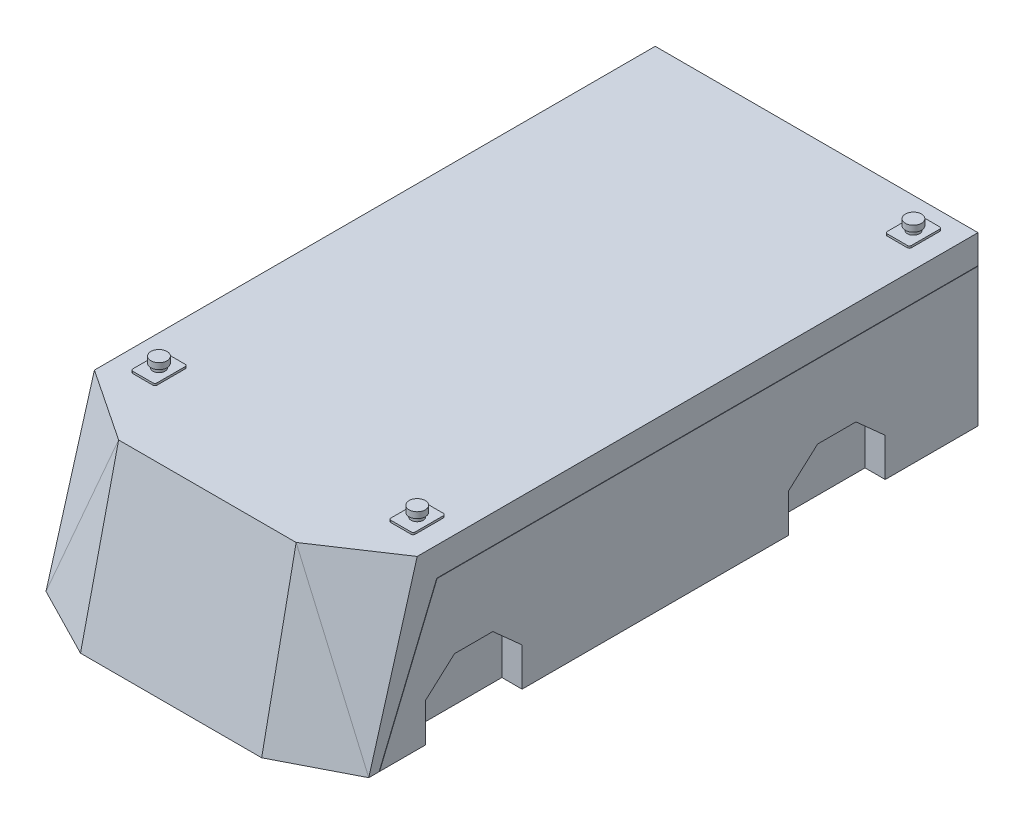
from build123d import *

# Parameters (mm, degrees)
CROQUIS1_W              = 800
CROQUIS1_H              = 1600
SALIENTE_EXTRUIR1_DEPTH = 415
CORTAR_EXTRUIR1_DEPTH   = 200
CORTAR_EXTRUIR2_DEPTH   = 200
CORTAR_EXTRUIR6_DEPTH   = 499
CORTAR_EXTRUIR8_DEPTH   = 359
CORTAR_EXTRUIR10_DEPTH  = 353
CORTAR_EXTRUIR12_DEPTH  = 514
CORTAR_EXTRUIR13_DEPTH  = 514
CORTAR_EXTRUIR16_DEPTH  = 50
CORTAR_EXTRUIR17_DEPTH  = 50
CORTAR_EXTRUIR18_DEPTH  = 1
CROQUIS20_W             = 800
CROQUIS20_H             = 1
CORTAR_EXTRUIR19_DEPTH  = 1
SALIENTE_EXTRUIR2_DEPTH = 5
CROQUIS22_R             = 15
SALIENTE_EXTRUIR3_DEPTH = 10
CROQUIS23_R             = 20
SALIENTE_EXTRUIR4_DEPTH = 15
SALIENTE_EXTRUIR5_DEPTH = 5
CROQUIS26_R             = 25
SALIENTE_EXTRUIR6_DEPTH = 75


with BuildPart() as part:
    # Croquis1 → Saliente-Extruir1 (new body)
    with BuildSketch(Plane(origin=(0, 0, 0), x_dir=(1, 0, 0), z_dir=(0, 1, 0))):
        with Locations((0, -407.98258177)):
            Rectangle(CROQUIS1_W, CROQUIS1_H)
    extrude(amount=SALIENTE_EXTRUIR1_DEPTH)

    # Croquis3 → Cortar-Extruir1 (cut)
    with BuildSketch(Plane(origin=(604.100569287, 262.019524028, 906.150853931), x_dir=(-0.8421068082275548, 0.1498081502111445, 0.5180865194802076), z_dir=(-0.5393107856670403, -0.23391793113269235, -0.8089661785005605))):
        Polygon((456.118589156, 88.118028239), (242.368981337, -310.549885139), (242.368981337, 121.451272267), align=None)
    extrude(amount=-CORTAR_EXTRUIR1_DEPTH, mode=Mode.SUBTRACT)

    # Croquis5 → Cortar-Extruir2 (cut)
    with BuildSketch(Plane(origin=(-604.100569287, 262.019524028, 906.150853931), x_dir=(-0.8421068082275548, -0.1498081502111445, -0.5180865194802076), z_dir=(0.5393107856670404, -0.2339179311326923, -0.8089661785005605))):
        Polygon((-242.368981337, -310.549885139), (-242.368981337, 121.451272267), (-456.118589156, 88.118028239), align=None)
    extrude(amount=-CORTAR_EXTRUIR2_DEPTH, mode=Mode.SUBTRACT)

    # Croquis8 → Cortar-Extruir6 (cut)
    with BuildSketch(Plane(origin=(0, 250.204627362, 1153.721337281), x_dir=(-1, 0, 0), z_dir=(0, -0.21194078521367435, -0.9772825095963864))):
        Polygon((220, 168.626135247), (400, -256.020776905), (-400, -256.020776905), (-220, 168.626135247), (0, 168.626135247), align=None)
    extrude(amount=-CORTAR_EXTRUIR6_DEPTH, mode=Mode.SUBTRACT)

    # Croquis12 → Cortar-Extruir8 (cut)
    with BuildSketch(Plane.XY.offset(1117.98258177)):
        Polygon((220, 415), (400, 0), (400, 415), align=None)
    extrude(amount=CORTAR_EXTRUIR8_DEPTH, mode=Mode.SUBTRACT)

    # Croquis14 → Cortar-Extruir10 (cut)
    with BuildSketch(Plane.XY.offset(1117.98258177)):
        Polygon((-220, 415), (-400, 0), (-400, 415), align=None)
    extrude(amount=CORTAR_EXTRUIR10_DEPTH, mode=Mode.SUBTRACT)

    # Croquis15 → Cortar-Extruir12 (cut)
    with BuildSketch(Plane(origin=(516.98244579, 224.233349981, 1008.11576929), x_dir=(-0.8942171635698928, 0.0971910742249457, 0.4369548712029846), z_dir=(-0.44763340400043405, -0.19415424751826063, -0.8728851378008463))):
        Polygon((327.082120211, -262.279632659), (130.821069596, -242.738649788), (332.114454842, 162.361304614), align=None)
    extrude(amount=-CORTAR_EXTRUIR12_DEPTH, mode=Mode.SUBTRACT)


with BuildPart() as body_2:
    # of the pieces the cut leaves, the one that is kept (cortar_extruir12_keep)
    add(part.part.solids().sort_by_distance((-400, 0, 1207.98258177))[0])

    # Croquis16 → Cortar-Extruir13 (cut)
    with BuildSketch(Plane(origin=(-516.98244579, 224.233349981, 1008.11576929), x_dir=(-0.8942171635698928, -0.09719107422494568, -0.43695487120298454), z_dir=(0.44763340400043394, -0.19415424751826066, -0.8728851378008463))):
        Polygon((-327.082120211, -262.279632659), (-332.114454842, 162.361304614), (-130.821069596, -242.738649788), align=None)
    extrude(amount=-CORTAR_EXTRUIR13_DEPTH, mode=Mode.SUBTRACT)


with BuildPart() as body_2_2:
    # of the pieces the cut leaves, the one that is kept (cortar_extruir13_keep)
    add(body_2.part.solids().sort_by_distance((224.5, 0, 1207.98258177))[0])

    # Croquis17 → Cortar-Extruir16 (cut)
    with BuildSketch(Plane(origin=(400, 0, 0), x_dir=(0, 0, -1), z_dir=(1, 0, 0))):
        Polygon((162.01741823, 0), (-77.98258177, 0), (-77.98258177, 95), (-5.48258177, 160), (89.51741823, 160), (162.01741823, 95), align=None)
        Polygon((-977.98258177, 0), (-737.98258177, 0), (-737.98258177, 95), (-810.48258177, 160), (-905.48258177, 160), (-977.98258177, 95), align=None)
    extrude(amount=-CORTAR_EXTRUIR16_DEPTH, mode=Mode.SUBTRACT)

    # Croquis18 → Cortar-Extruir17 (cut)
    with BuildSketch(Plane.ZY.offset(400)):
        Polygon((-162.01741823, 0), (77.98258177, 0), (77.98258177, 95), (5.48258177, 160), (-89.51741823, 160), (-162.01741823, 95), align=None)
        Polygon((977.98258177, 0), (737.98258177, 0), (737.98258177, 95), (810.48258177, 160), (905.48258177, 160), (977.98258177, 95), align=None)
    extrude(amount=-CORTAR_EXTRUIR17_DEPTH, mode=Mode.SUBTRACT)

    # Croquis19 → Cortar-Extruir18 (cut)
    with BuildSketch(Plane(origin=(400, 0, 0), x_dir=(0, 0, -1), z_dir=(1, 0, 0))):
        Polygon((392.01741823, 343), (-948.718987098, 343), (-1091.223533976, 0), (-1092.306405756, 0), (-949.386393727, 344), (392.01741823, 344), align=None)
    cortar_extruir18 = extrude(amount=-CORTAR_EXTRUIR18_DEPTH, mode=Mode.SUBTRACT)

    # Croquis20 → Cortar-Extruir19 (cut)
    with BuildSketch(Plane(origin=(0, 0, -392.01741823), x_dir=(-1, 0, 0), z_dir=(0, 0, -1))):
        with Locations((0, 343.5)):
            Rectangle(CROQUIS20_W, CROQUIS20_H)
    extrude(amount=-CORTAR_EXTRUIR19_DEPTH, mode=Mode.SUBTRACT)

    # Simetría1: Cortar-Extruir18 across plane
    add(cortar_extruir18.mirror(Plane.ZY), mode=Mode.SUBTRACT)

    # Croquis21 → Saliente-Extruir2 (add)
    with BuildSketch(Plane(origin=(0, 415, 0), x_dir=(1, 0, 0), z_dir=(0, 1, 0))):
        with BuildLine():
            Line((295, 272.01741823), (345, 272.01741823))
            ThreePointArc((345, 272.01741823), (348.535533906, 273.481884325), (350, 277.01741823))
            Line((350, 277.01741823), (350, 347.01741823))
            ThreePointArc((350, 347.01741823), (348.535533906, 350.552952136), (345, 352.01741823))
            Line((345, 352.01741823), (295, 352.01741823))
            ThreePointArc((295, 352.01741823), (291.464466094, 350.552952136), (290, 347.01741823))
            Line((290, 347.01741823), (290, 277.01741823))
            ThreePointArc((290, 277.01741823), (291.464466094, 273.481884325), (295, 272.01741823))
        make_face()
        with BuildLine():
            Line((290, -882.98258177), (290, -952.98258177))
            ThreePointArc((290, -952.98258177), (291.464466094, -956.518115675), (295, -957.98258177))
            Line((295, -957.98258177), (345, -957.98258177))
            ThreePointArc((345, -957.98258177), (348.535533906, -956.518115675), (350, -952.98258177))
            Line((350, -952.98258177), (350, -882.98258177))
            ThreePointArc((350, -882.98258177), (348.535533906, -879.447047864), (345, -877.98258177))
            Line((345, -877.98258177), (295, -877.98258177))
            ThreePointArc((295, -877.98258177), (291.464466094, -879.447047864), (290, -882.98258177))
        make_face()
        with BuildLine():
            Line((-295, -877.98258177), (-345, -877.98258177))
            ThreePointArc((-345, -877.98258177), (-348.535533906, -879.447047864), (-350, -882.98258177))
            Line((-350, -882.98258177), (-350, -952.98258177))
            ThreePointArc((-350, -952.98258177), (-348.535533906, -956.518115675), (-345, -957.98258177))
            Line((-345, -957.98258177), (-295, -957.98258177))
            ThreePointArc((-295, -957.98258177), (-291.464466094, -956.518115675), (-290, -952.98258177))
            Line((-290, -952.98258177), (-290, -882.98258177))
            ThreePointArc((-290, -882.98258177), (-291.464466094, -879.447047864), (-295, -877.98258177))
        make_face()
    extrude(amount=SALIENTE_EXTRUIR2_DEPTH)

    # Croquis22 → Saliente-Extruir3 (add)
    with BuildSketch(Plane(origin=(0, 420, 0), x_dir=(1, 0, 0), z_dir=(0, 1, 0))):
        with Locations((320, 312.01741823)):
            Circle(CROQUIS22_R)
        with Locations((320, -917.98258177)):
            Circle(CROQUIS22_R)
        with Locations((-320, -917.98258177)):
            Circle(CROQUIS22_R)
    extrude(amount=SALIENTE_EXTRUIR3_DEPTH)

    # Croquis23 → Saliente-Extruir4 (add)
    with BuildSketch(Plane(origin=(0, 430, 0), x_dir=(1, 0, 0), z_dir=(0, 1, 0))):
        with Locations((320, 312.01741823)):
            Circle(CROQUIS23_R)
        with Locations((320, -917.98258177)):
            Circle(CROQUIS23_R)
        with Locations((-320, -917.98258177)):
            Circle(CROQUIS23_R)
    extrude(amount=SALIENTE_EXTRUIR4_DEPTH)

    # Croquis25 → Saliente-Extruir5 (add)
    with BuildSketch(Plane.XZ):
        with BuildLine():
            Line((-30, -476.764876907), (-30, -392.01741823))
            Line((-30, -392.01741823), (30, -392.01741823))
            Line((30, -392.01741823), (30, -476.764876907))
            ThreePointArc((30, -476.764876907), (0, -506.764876907), (-30, -476.764876907))
        make_face()
    extrude(amount=-SALIENTE_EXTRUIR5_DEPTH)

    # Croquis26 → Saliente-Extruir6 (add)
    with BuildSketch(Plane(origin=(0, 5, 0), x_dir=(1, 0, 0), z_dir=(0, 1, 0))):
        with Locations((0, 476.764876907)):
            Circle(CROQUIS26_R)
    extrude(amount=SALIENTE_EXTRUIR6_DEPTH)

    # Croquis28 → Cortar-Revolución7 (revolve, cut)
    with BuildSketch(Plane.ZY):
        with BuildLine():
            Line((-451.764876907, 5), (-451.764876907, 55))
            ThreePointArc((-451.764876907, 55), (-454.267783945, 44.096752398), (-461.275341569, 35.376690009))
            add(Edge.make_bspline(
                [(-461.275341569, 35.376690009), (-479.429840017, 14.56995995), (-453.764876907, 5)],
                knots=[0, 0, 0, 1, 1, 1], degree=2))
            Line((-453.764876907, 5), (-451.764876907, 5))
        make_face()
    revolve(axis=Axis((0, 90.386786237, -476.764876907), (0, -1, 0)), mode=Mode.SUBTRACT)

    # Croquis29 → Cortar-Revolución26 (revolve, cut)
    with BuildSketch(Plane.ZY):
        with BuildLine():
            Line((-475.149447102, 80), (-475.149447102, 84.514502028))
            Line((-475.149447102, 84.514502028), (-446.334832781, 84.514502028))
            Line((-446.334832781, 84.514502028), (-446.334832781, 57.478552518))
            Line((-446.334832781, 57.478552518), (-451.764876907, 56.615429804))
            ThreePointArc((-451.764876907, 56.615429804), (-459.050340313, 72.714536594), (-475.149447102, 80))
        make_face()
    revolve(axis=Axis((0, 80, -476.764876907), (0, -1, 0)), mode=Mode.SUBTRACT)


solid = body_2_2.part
